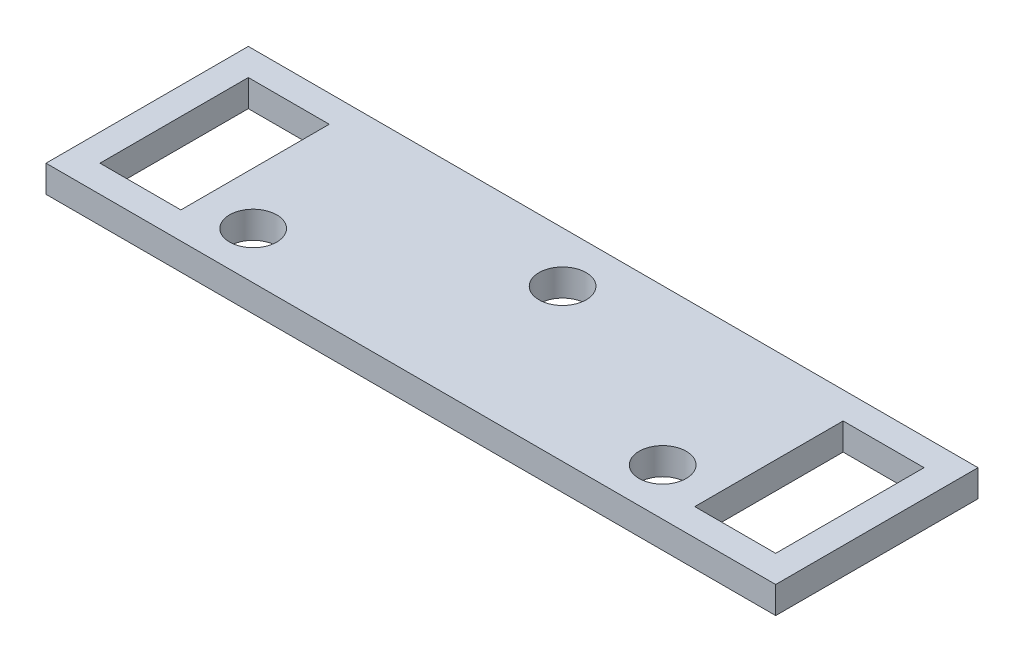
from build123d import *

# Parameters (mm, degrees)
SKETCH1_W           = 54.1
SKETCH1_H           = 15
SKETCH1_R           = 1.75
SKETCH1_W_2         = 6
SKETCH1_H_2         = 11
BOSS_EXTRUDE1_DEPTH = 2


with BuildPart() as part:
    # Sketch1 → Boss-Extrude1 (new body)
    with BuildSketch(Plane(origin=(0, 0, 0), x_dir=(1, 0, 0), z_dir=(0, 1, 0))):
        with Locations((1.576423546, 0.819405027)):
            Rectangle(SKETCH1_W, SKETCH1_H)
        with Locations(Location((16.756423546, -3.190594973, 0), (0, 0, 270))):
            Circle(SKETCH1_R, mode=Mode.SUBTRACT)
        with Locations(Location((-13.603576454, -3.190594973, 0), (0, 0, 270))):
            Circle(SKETCH1_R, mode=Mode.SUBTRACT)
        with Locations(Location((1.576423546, 4.569405027, 0), (0, 0, 270))):
            Circle(SKETCH1_R, mode=Mode.SUBTRACT)
        with Locations((-20.473576454, 0.819405027)):
            Rectangle(SKETCH1_W_2, SKETCH1_H_2, mode=Mode.SUBTRACT)
        with Locations((23.626423546, 0.819405027)):
            Rectangle(SKETCH1_W_2, SKETCH1_H_2, mode=Mode.SUBTRACT)
    extrude(amount=BOSS_EXTRUDE1_DEPTH)


solid = part.part
